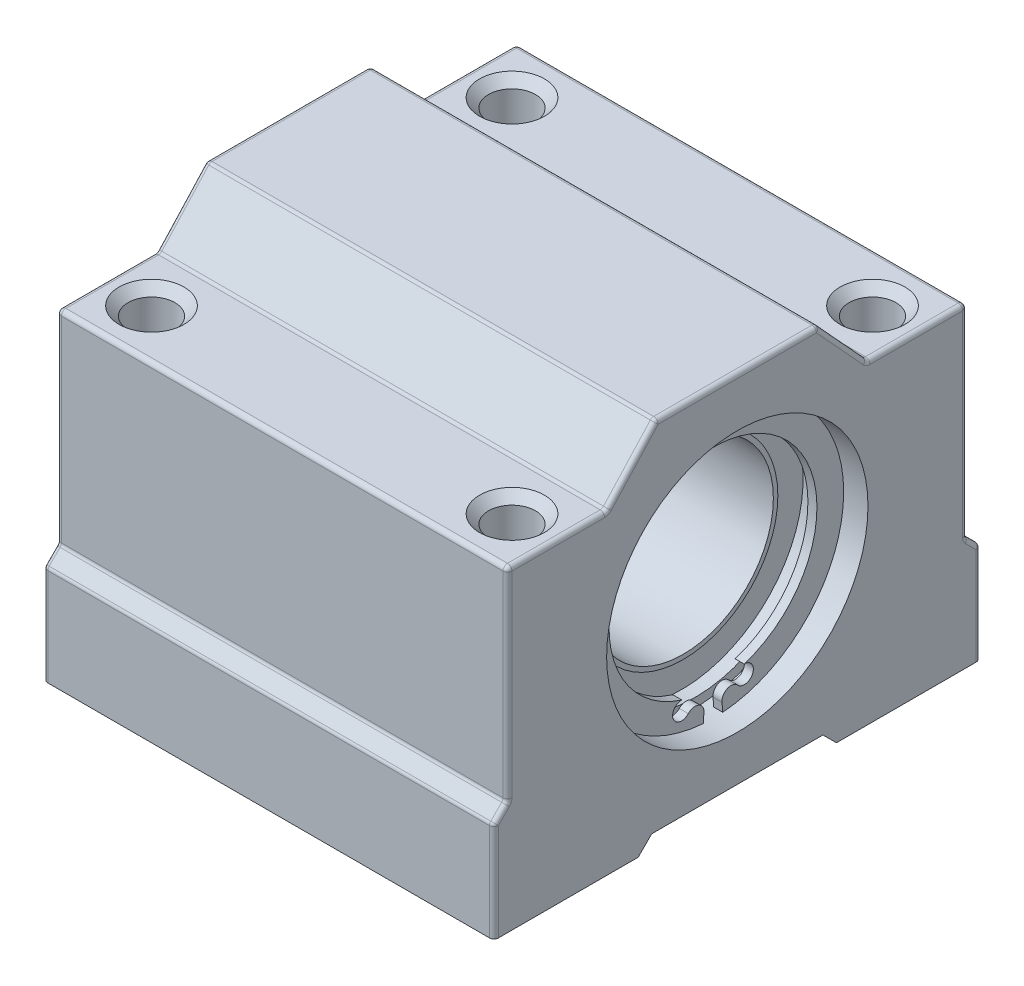
from build123d import *

# Parameters (mm, degrees)
SKETCH1_R           = 14.5
BOSS_EXTRUDE1_DEPTH = 50
EXTRUDE_THIN1_START = 0.5
SKETCH1_4_R         = 10.5
SKETCH1_4_R_2       = 10
EXTRUDE_THIN1_DEPTH = 43.5
BOSS_EXTRUDE2_START = 0.8
SKETCH1_5_R         = 13.5
SKETCH1_5_R_2       = 10
BOSS_EXTRUDE2_DEPTH = 43
BOSS_EXTRUDE3_START = 0.3
SKETCH1_6_R         = 14.5
SKETCH1_6_R_2       = 13.5
BOSS_EXTRUDE3_DEPTH = 45
BOSS_EXTRUDE4_START = 1
BOSS_EXTRUDE4_DEPTH = 1
FILLET1_R           = 0.5
SKETCH4_R           = 2.6
CUT_EXTRUDE3_DEPTH  = 71.071392165
CHAMFER1_SIZE       = 1


with BuildPart() as part:
    # Sketch1 → Boss-Extrude1 (new body)
    with BuildSketch(Plane(origin=(0, 0, 0), x_dir=(0, 0, -1), z_dir=(1, 0, 0))):
        Polygon((-27, -21), (-11, -21), (-9.5, -19.5), (9.5, -19.5), (11, -21), (27, -21), (27, -10), (25.5, -8.5), (25.5, 14), (14.5, 14), (9, 20), (-9, 20), (-14.5, 14), (-25.5, 14), (-25.5, -8.5), (-27, -10), align=None)
        Circle(SKETCH1_R, mode=Mode.SUBTRACT)
    extrude(amount=BOSS_EXTRUDE1_DEPTH)



with BuildPart() as body_2:
    # Sketch1<4> → Extrude-Thin1 (new body)
    with BuildSketch(Plane(origin=(0, 0, 0), x_dir=(0, 0, -1), z_dir=(1, 0, 0)).offset(EXTRUDE_THIN1_START)):
        Circle(SKETCH1_4_R)
        Circle(SKETCH1_4_R_2, mode=Mode.SUBTRACT)
    extrude(amount=EXTRUDE_THIN1_DEPTH)

    # Sketch1<5> → Boss-Extrude2 (add)
    with BuildSketch(Plane(origin=(0, 0, 0), x_dir=(0, 0, -1), z_dir=(1, 0, 0)).offset(BOSS_EXTRUDE2_START)):
        Circle(SKETCH1_5_R)
        Circle(SKETCH1_5_R_2, mode=Mode.SUBTRACT)
    extrude(amount=BOSS_EXTRUDE2_DEPTH)


with BuildPart() as part_1:
    add(part.part)

    add(body_2.part)  # Boss-Extrude3 merges body 2
    # Sketch1<6> → Boss-Extrude3 (add)
    with BuildSketch(Plane(origin=(0, 0, 0), x_dir=(0, 0, -1), z_dir=(1, 0, 0)).offset(BOSS_EXTRUDE3_START)):
        Circle(SKETCH1_6_R)
        Circle(SKETCH1_6_R_2, mode=Mode.SUBTRACT)
    extrude(amount=BOSS_EXTRUDE3_DEPTH)

    # Sketch3 → Boss-Extrude4 (add)
    with BuildSketch(Plane(origin=(45.3, 0, 0), x_dir=(0, 0, -1), z_dir=(1, 0, 0)).offset(BOSS_EXTRUDE4_START)):
        with BuildLine():
            Line((-1.006226387, -13.462448086), (-1.080761675, -14.459666462))
            ThreePointArc((-1.080761675, -14.459666462), (0, 14.5), (1.080761675, -14.459666462))
            Line((1.080761675, -14.459666462), (1.006226387, -13.462448086))
            ThreePointArc((1.006226387, -13.462448086), (1.587963278, -12.439862683), (2.739999666, -12.678422687))
            ThreePointArc((2.739999666, -12.678422687), (4.399101385, -12.399835015), (3.456933265, -11.006081508))
            ThreePointArc((3.456933265, -11.006081508), (0, 11.53621332), (-3.456933265, -11.006081508))
            ThreePointArc((-3.456933265, -11.006081508), (-4.399101385, -12.399835015), (-2.739999666, -12.678422687))
            ThreePointArc((-2.739999666, -12.678422687), (-1.587963278, -12.439862683), (-1.006226387, -13.462448086))
        make_face()
    extrude(amount=BOSS_EXTRUDE4_DEPTH)

    # Fillet1
    fillet1_edges = [part_1.edges().sort_by_distance(p)[0] for p in [
        (25, -8.5, -25.5),
        (25, -8.5, 25.5),
        (25, -10, 27),
        (25, -10, -27),
        (25, 14, -14.5),
        (25, 14, 14.5),
        (25, 20, 9),
        (25, 20, -9),
        (25, 14, -25.5),
        (25, 14, 25.5),
        (50, 17, -11.75),
        (50, 17, 11.75),
        (50, 2.75, 25.5),
        (0, -9.25, 26.25),
        (0, 17, 11.75),
        (50, -9.25, -26.25),
        (50, -15.5, -27),
        (50, 2.75, -25.5),
        (50, 20, 0),
        (50, 14, -20),
        (50, 14, 20),
        (50, -9.25, 26.25),
        (50, -15.5, 27),
        (0, -15.5, -27),
        (0, -9.25, -26.25),
        (0, 2.75, -25.5),
        (0, 17, -11.75),
        (0, 14, -20),
        (0, 20, 0),
        (0, -15.5, 27),
        (0, 2.75, 25.5),
        (0, 14, 20),
    ]]
    fillet(fillet1_edges, radius=FILLET1_R)

    # Sketch4 → Cut-Extrude3 (cut, through all)
    with BuildSketch(Plane.XZ.offset(21)):
        with Locations((5, 20)):
            Circle(SKETCH4_R)
        with Locations((45, 20)):
            Circle(SKETCH4_R)
        with Locations((45, -20)):
            Circle(SKETCH4_R)
        with Locations((5, -20)):
            Circle(SKETCH4_R)
    extrude(amount=-CUT_EXTRUDE3_DEPTH, mode=Mode.SUBTRACT)

    # Chamfer1
    chamfer1_edges = [part_1.edges().sort_by_distance(p)[0] for p in [
        (42.4, 14, -20),
        (2.4, 14, -20),
        (2.4, 14, 20),
        (42.4, 14, 20),
        (42.4, -21, 20),
        (2.4, -21, 20),
    ]]
    chamfer(chamfer1_edges, length=CHAMFER1_SIZE)


solid = part_1.part
